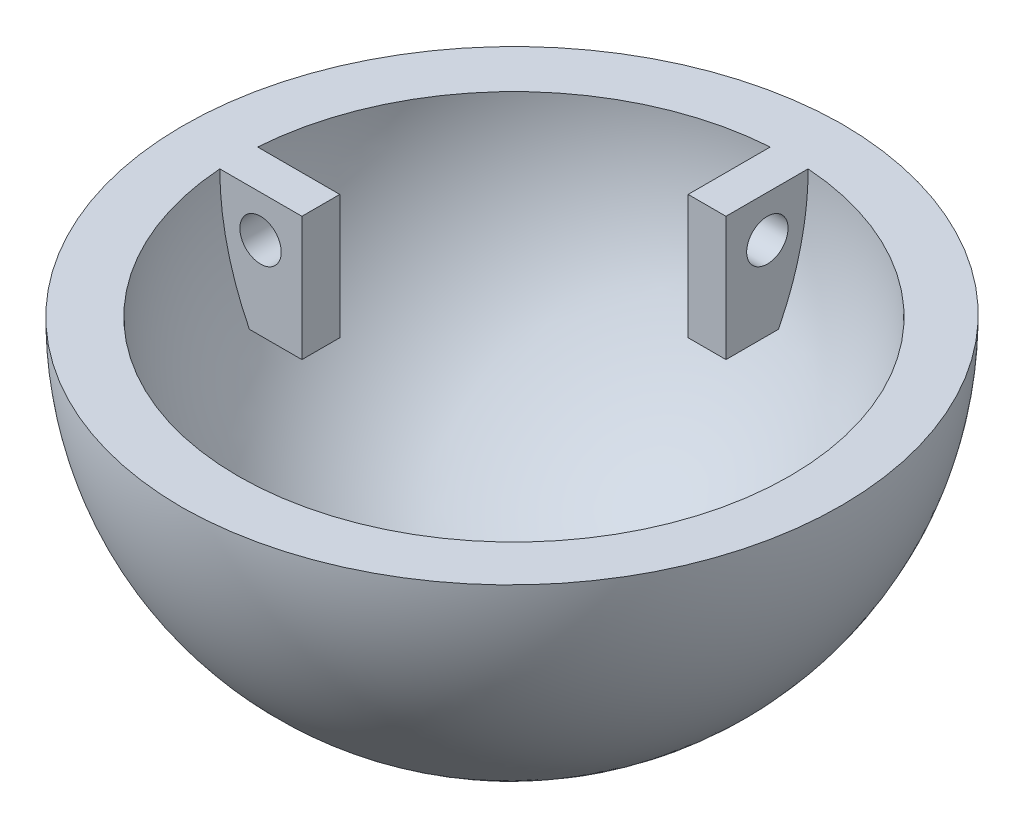
from build123d import *

# Parameters (mm, degrees)
REVOLVE1_ANGLE      = 180
SKETCH3_W           = 1.371722334
SKETCH3_H           = 4
SKETCH3_W_2         = 4
SKETCH3_H_2         = 1.371722334
BOSS_EXTRUDE1_DEPTH = 4.5
CUT_EXTRUDE1_REACH  = 23.148
SKETCH4_R           = 0.75
CUT_EXTRUDE2_REACH  = 23.148
SKETCH5_R           = 0.75


with BuildPart() as part:
    # Sketch1 → Revolve1 (revolve)
    with BuildSketch(Plane(origin=(0, 0, 0), x_dir=(1, 0, 0), z_dir=(0, 1, 0))):
        with BuildLine():
            Line((-0.14015916, 11.999181447), (0, -12))
            ThreePointArc((0, -12), (-11.99979536, -0.070080775), (-0.14015916, 11.999181447))
        make_face()
    revolve(axis=Axis((-0.14015916, 0, -11.999181447), (0.005840064605885622, 0, 0.9999829466772917)), revolution_arc=REVOLVE1_ANGLE)

    # Sketch2 → Cut-Revolve1 (revolve, cut)
    with BuildSketch(Plane(origin=(0, 0, 0), x_dir=(1, 0, 0), z_dir=(0, 1, 0))):
        with BuildLine():
            Line((0, -10), (0, 10))
            ThreePointArc((0, 10), (-10, 0), (0, -10))
        make_face()
    revolve(axis=Axis((0, 0, 10), (0, 0, -1)), mode=Mode.SUBTRACT)

    # Sketch3 → Boss-Extrude1 (add)
    with BuildSketch(Plane(origin=(0, 0, 0), x_dir=(1, 0, 0), z_dir=(0, 1, 0))):
        with Locations((0, 8.99979536)):
            Rectangle(SKETCH3_W, SKETCH3_H)
        with Locations((-8.99979536, 0)):
            Rectangle(SKETCH3_W_2, SKETCH3_H_2)
    extrude(amount=-BOSS_EXTRUDE1_DEPTH)

    # Sketch4 → Cut-Extrude1 (cut, up to next)
    with BuildSketch(Plane(origin=(0, 0, -0.685861167), x_dir=(-1, 0, 0), z_dir=(0, 0, -1)), mode=Mode.PRIVATE) as cut_extrude1_sk1:
        with Locations((8.49979536, -1.5)):
            Circle(SKETCH4_R)
    cut_extrude1_tool1 = extrude(cut_extrude1_sk1.sketch, amount=-CUT_EXTRUDE1_REACH, mode=Mode.PRIVATE) & part.part
    add(cut_extrude1_tool1.solids().sort_by_distance((-8.499795, -1.5, -0.685861))[0], mode=Mode.SUBTRACT)

    # Sketch5 → Cut-Extrude2 (cut, up to next)
    with BuildSketch(Plane(origin=(0.685861167, 0, 0), x_dir=(0, 0, -1), z_dir=(1, 0, 0)), mode=Mode.PRIVATE) as cut_extrude2_sk1:
        with Locations((8.49979536, -1.5)):
            Circle(SKETCH5_R)
    cut_extrude2_tool1 = extrude(cut_extrude2_sk1.sketch, amount=-CUT_EXTRUDE2_REACH, mode=Mode.PRIVATE) & part.part
    add(cut_extrude2_tool1.solids().sort_by_distance((0.685861, -1.5, -8.499795))[0], mode=Mode.SUBTRACT)


solid = part.part
